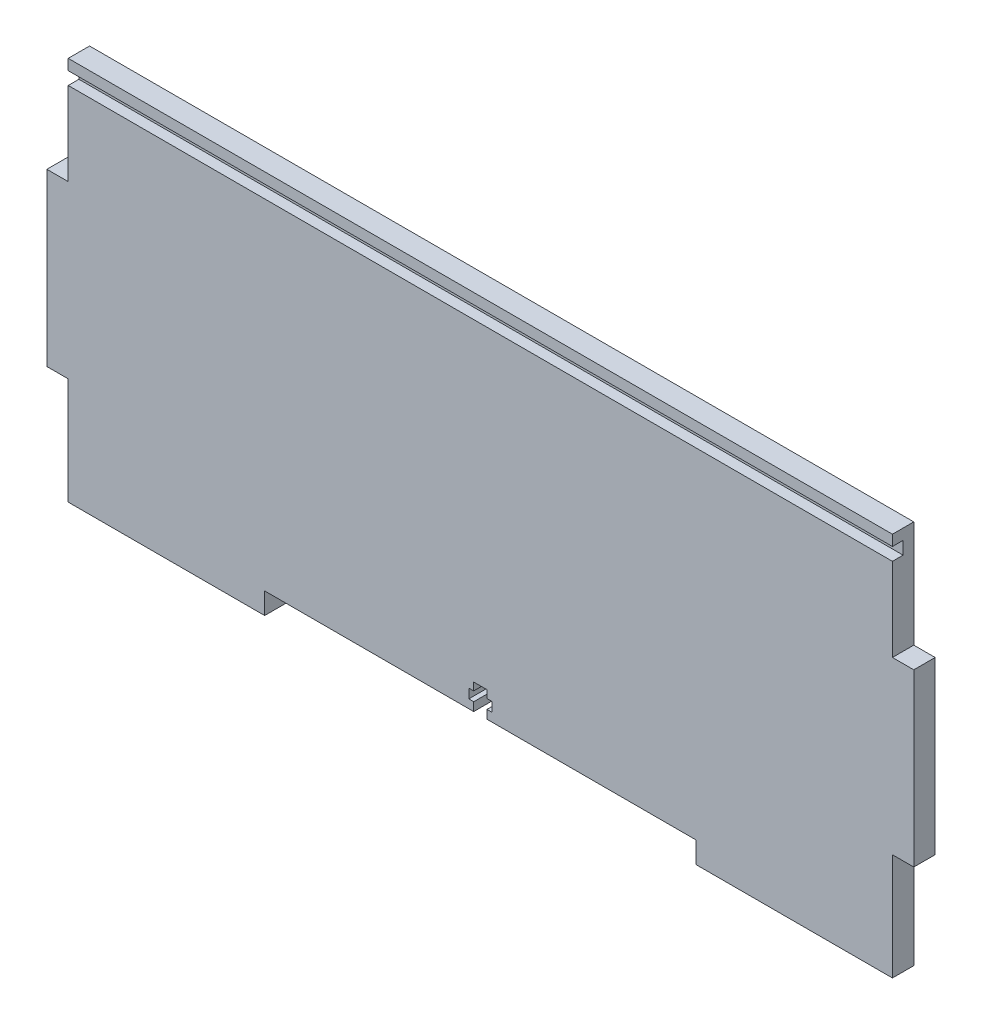
from build123d import *

# Parameters (mm, degrees)
SKETCH1_W           = 203
SKETCH1_H           = 90
BOSS_EXTRUDE1_DEPTH = 5
SKETCH3_W           = 5
SKETCH3_H           = 25
SKETCH3_W_2         = 101
SKETCH3_H_2         = 5
CUT_EXTRUDE2_DEPTH  = 223.112584065
SKETCH4_W           = 193
SKETCH4_H           = 3
CUT_EXTRUDE3_DEPTH  = 2.5
SKETCH5_W           = 3.1
SKETCH5_H           = 1.8
SKETCH5_H_2         = 2.2
SKETCH5_W_2         = 1.15
SKETCH5_H_3         = 2
CUT_EXTRUDE4_DEPTH  = 223.112584065


with BuildPart() as part:
    # Sketch1 → Boss-Extrude1 (new body)
    with BuildSketch(Plane.XY):
        with Locations((101.5, 45)):
            Rectangle(SKETCH1_W, SKETCH1_H)
    extrude(amount=BOSS_EXTRUDE1_DEPTH)

    # Sketch3 → Cut-Extrude2 (cut, through all)
    with BuildSketch(Plane.XY.offset(5)):
        with Locations((2.5, 12.5)):
            Rectangle(SKETCH3_W, SKETCH3_H)
        with Locations((2.5, 77.5)):
            Rectangle(SKETCH3_W, SKETCH3_H)
        with Locations((200.5, 12.5)):
            Rectangle(SKETCH3_W, SKETCH3_H)
        with Locations((200.5, 77.5)):
            Rectangle(SKETCH3_W, SKETCH3_H)
        with Locations((101.5, 2.5)):
            Rectangle(SKETCH3_W_2, SKETCH3_H_2)
    extrude(amount=-CUT_EXTRUDE2_DEPTH, mode=Mode.SUBTRACT)

    # Sketch4 → Cut-Extrude3 (cut)
    with BuildSketch(Plane.XY.offset(5)):
        with Locations((101.5, 86)):
            Rectangle(SKETCH4_W, SKETCH4_H)
    extrude(amount=-CUT_EXTRUDE3_DEPTH, mode=Mode.SUBTRACT)

    # Sketch5 → Cut-Extrude4 (cut, through all)
    with BuildSketch(Plane.XY.offset(5)):
        with Locations((101.5, 10.1)):
            Rectangle(SKETCH5_W, SKETCH5_H)
        with Locations((101.5, 8.1)):
            Rectangle(SKETCH5_W, SKETCH5_H_2)
        with Locations((99.375, 8.1)):
            Rectangle(SKETCH5_W_2, SKETCH5_H_2)
        with Locations((103.625, 8.1)):
            Rectangle(SKETCH5_W_2, SKETCH5_H_2)
        with Locations((101.5, 6)):
            Rectangle(SKETCH5_W, SKETCH5_H_3)
    extrude(amount=-CUT_EXTRUDE4_DEPTH, mode=Mode.SUBTRACT)


solid = part.part
